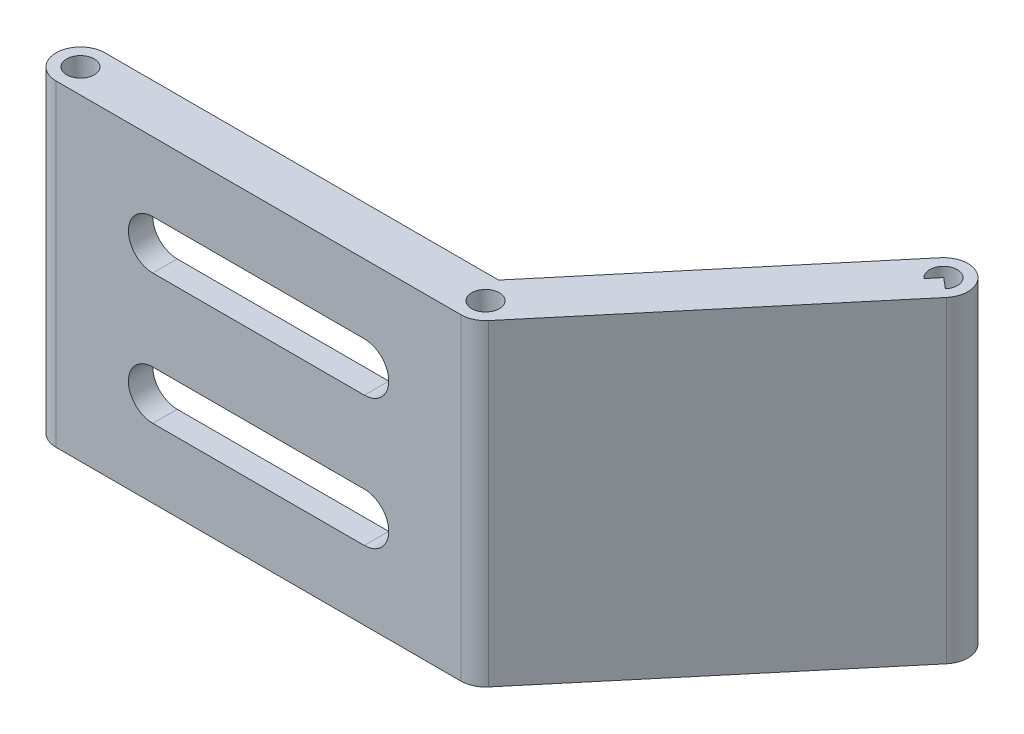
from build123d import *

# Parameters (mm, degrees)
SKETCH_1_R          = 1.7
EXTRUDE_1_DEPTH     = 39
FILLET_1_R          = 10
EXTRUDE_2_DEPTH     = 5
EXTRUDE_START       = -3
SKETCH_4_R          = 1.7
EXTRUDE_3_DEPTH     = 3
CUT_EXTRUDE_2_DEPTH = 5
SKETCH_6_R          = 1.7
EXTRUDE_4_DEPTH     = 3
SKETCH_7_R          = 1.7
EXTRUDE_5_DEPTH     = 5
SKETCH_8_R          = 3
SKETCH_8_R_2        = 1.7
EXTRUDE_6_DEPTH     = 39


with BuildPart() as part:
    # 草图1 → 凸台-拉伸1 (new body)
    with BuildSketch(Plane(origin=(0, 0, 0), x_dir=(1, 0, 0), z_dir=(0, 1, 0))):
        with BuildLine():
            Line((-14.277701198, -3), (35.505461262, -3))
            ThreePointArc((35.505461262, -3), (36.773316047, -2.718923361), (37.803594591, -1.928362829))
            Line((37.803594591, -1.928362829), (63.497014217, 28.691862316))
            Line((63.497014217, 28.691862316), (61.198880888, 30.620225145))
            Line((61.198880888, 30.620225145), (37.433824091, 2.298133329))
            ThreePointArc((37.433824091, 2.298133329), (34.237606477, 2.718923361), (32.505461262, 0))
            Line((32.505461262, 0), (-11.277701198, 0))
            ThreePointArc((-11.277701198, 0), (-16.399021541, 2.121320344), (-14.277701198, -3))
        make_face()
        with Locations(Location((-14.277701198, 0, 0), (0, 0, 270))):
            Circle(SKETCH_1_R, mode=Mode.SUBTRACT)
        with Locations(Location((35.505461262, 0, 0), (0, 0, 270))):
            Circle(SKETCH_1_R, mode=Mode.SUBTRACT)
    extrude(amount=EXTRUDE_1_DEPTH)

    # 圆角1
    fillet_1_edges = [part.edges().sort_by_distance(p)[0] for p in [
        (37.433824091, 19.5, -2.298133329),
        (-11.277701198, 19.5, 0),
        (32.505461262, 19.5, 0),
    ]]
    fillet(fillet_1_edges, radius=FILLET_1_R)

    # 草图3 → 凸台-拉伸2 (add)
    with BuildSketch(Plane(origin=(0, 0, 0), x_dir=(1, 0, 0), z_dir=(0, 1, 0))):
        with BuildLine():
            Line((-14.277701198, 3), (35.505461262, 3))
            ThreePointArc((35.505461262, 3), (38.505461262, 0), (35.505461262, -3))
            Line((35.505461262, -3), (-14.277701198, -3))
            ThreePointArc((-14.277701198, -3), (-17.277701198, 0), (-14.277701198, 3))
        make_face()
    extrude(amount=EXTRUDE_2_DEPTH)

    # 草图4 → 凸台-拉伸3 (add)
    with BuildSketch(Plane(origin=(0, 39, 0), x_dir=(1, 0, 0), z_dir=(0, 1, 0)).offset(EXTRUDE_START)):
        with BuildLine():
            Line((-14.277701198, 3), (35.505461262, 3))
            ThreePointArc((35.505461262, 3), (38.505461262, 0), (35.505461262, -3))
            Line((35.505461262, -3), (-14.277701198, -3))
            ThreePointArc((-14.277701198, -3), (-17.277701198, 0), (-14.277701198, 3))
        make_face()
        with Locations(Location((-14.277701198, 0, 0), (0, 0, 270))):
            Circle(SKETCH_4_R, mode=Mode.SUBTRACT)
        with Locations(Location((35.505461262, 0, 0), (0, 0, 270))):
            Circle(SKETCH_4_R, mode=Mode.SUBTRACT)
    extrude(amount=EXTRUDE_3_DEPTH)

    # 草图5 → 切除-拉伸2 (cut)
    with BuildSketch(Plane.XY.offset(3)):
        with BuildLine():
            Line((-2.386119968, 30.5), (23.613880032, 30.5))
            ThreePointArc((23.613880032, 30.5), (26.613880032, 27.5), (23.613880032, 24.5))
            Line((23.613880032, 24.5), (-2.386119968, 24.5))
            ThreePointArc((-2.386119968, 24.5), (-5.386119968, 27.5), (-2.386119968, 30.5))
        make_face()
        with BuildLine():
            Line((-2.386119968, 8.5), (23.613880032, 8.5))
            ThreePointArc((23.613880032, 8.5), (26.613880032, 11.5), (23.613880032, 14.5))
            Line((23.613880032, 14.5), (-2.386119968, 14.5))
            ThreePointArc((-2.386119968, 14.5), (-5.386119968, 11.5), (-2.386119968, 8.5))
        make_face()
    extrude(amount=-CUT_EXTRUDE_2_DEPTH, mode=Mode.SUBTRACT)

    # 草图6 → 凸台-拉伸4 (add)
    with BuildSketch(Plane(origin=(0, 39, 0), x_dir=(1, 0, 0), z_dir=(0, 1, 0)).offset(EXTRUDE_START)):
        with BuildLine():
            Line((33.207327933, 1.928362829), (58.890388489, 32.536242516))
            ThreePointArc((58.890388489, 32.536242516), (63.116884647, 32.906013016), (63.486655148, 28.679516858))
            Line((63.486655148, 28.679516858), (37.803594591, -1.928362829))
            ThreePointArc((37.803594591, -1.928362829), (33.577098433, -2.298133329), (33.207327933, 1.928362829))
        make_face()
        with Locations(Location((35.505461262, 0, 0), (0, 0, 270))):
            Circle(SKETCH_6_R, mode=Mode.SUBTRACT)
        with Locations((61.188521818, 30.607879687)):
            Circle(SKETCH_6_R, mode=Mode.SUBTRACT)
    extrude(amount=EXTRUDE_4_DEPTH)

    # 草图7 → 凸台-拉伸5 (add)
    with BuildSketch(Plane(origin=(0, 0, 0), x_dir=(1, 0, 0), z_dir=(0, 1, 0))):
        with BuildLine():
            Line((33.207327933, 1.928362829), (58.890388489, 32.536242516))
            ThreePointArc((58.890388489, 32.536242516), (63.116884647, 32.906013016), (63.486655148, 28.679516858))
            Line((63.486655148, 28.679516858), (37.803594591, -1.928362829))
            ThreePointArc((37.803594591, -1.928362829), (33.577098433, -2.298133329), (33.207327933, 1.928362829))
        make_face()
        with Locations(Location((35.505461262, 0, 0), (0, 0, 270))):
            Circle(SKETCH_7_R, mode=Mode.SUBTRACT)
        with Locations((61.188521818, 30.607879687)):
            Circle(SKETCH_7_R, mode=Mode.SUBTRACT)
    extrude(amount=EXTRUDE_5_DEPTH)

    # 草图8 → 凸台-拉伸6 (add)
    with BuildSketch(Plane(origin=(0, 0, 0), x_dir=(1, 0, 0), z_dir=(0, 1, 0))):
        with Locations((61.188521818, 30.607879687)):
            Circle(SKETCH_8_R)
        with Locations((61.188521818, 30.607879687)):
            Circle(SKETCH_8_R_2, mode=Mode.SUBTRACT)
    extrude(amount=EXTRUDE_6_DEPTH)


solid = part.part
